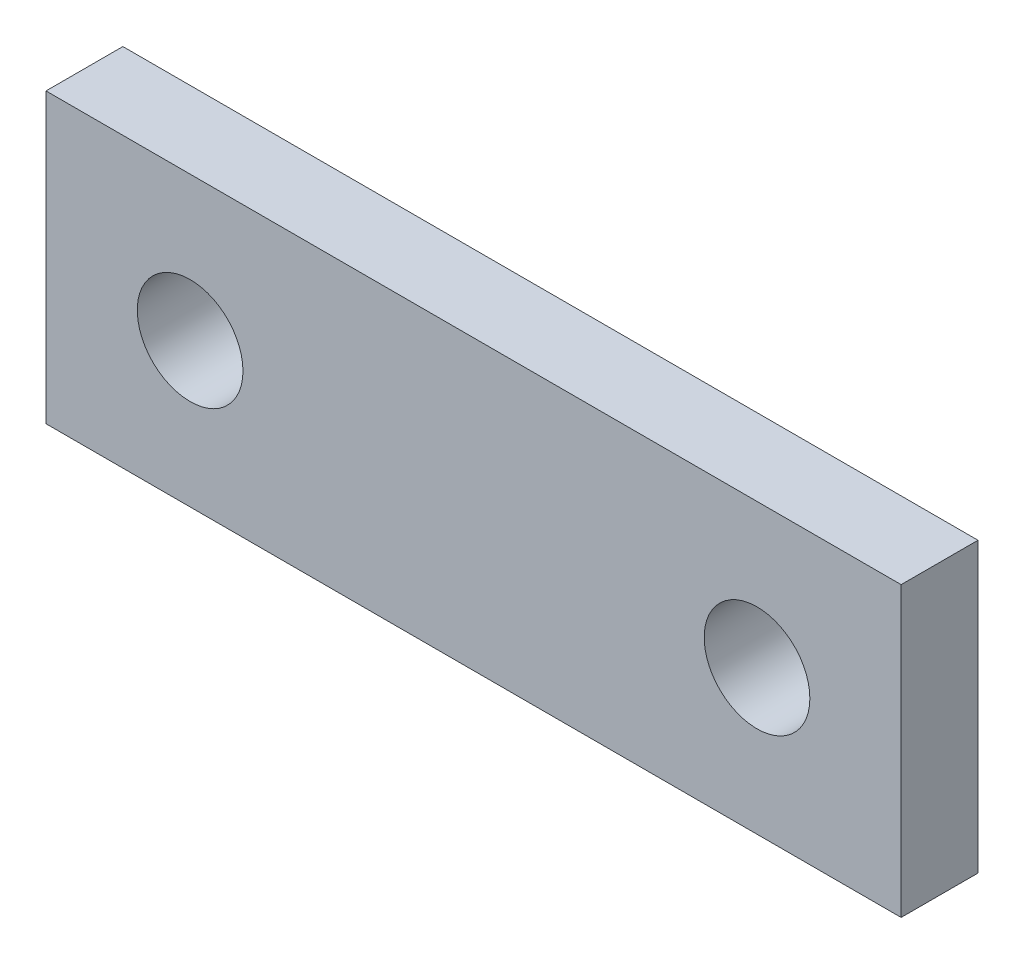
from build123d import *

# Parameters (mm, degrees)
SKETCH_1_W          = 178
SKETCH_1_H          = 60
EXTRUDE_1_DEPTH     = 16
SKETCH_2_R          = 11
CUT_EXTRUDE_2_DEPTH = 189.520555908


with BuildPart() as part:
    # 草图1 → 拉伸1 (new body)
    with BuildSketch(Plane.XY):
        with Locations((89, 30)):
            Rectangle(SKETCH_1_W, SKETCH_1_H)
    extrude(amount=EXTRUDE_1_DEPTH)

    # 草图2 → 拉伸2 (cut, through all)
    with BuildSketch(Plane.XY.offset(16)):
        with Locations((30, 30)):
            Circle(SKETCH_2_R)
        with Locations((148, 30)):
            Circle(SKETCH_2_R)
    extrude(amount=-CUT_EXTRUDE_2_DEPTH, mode=Mode.SUBTRACT)


solid = part.part
